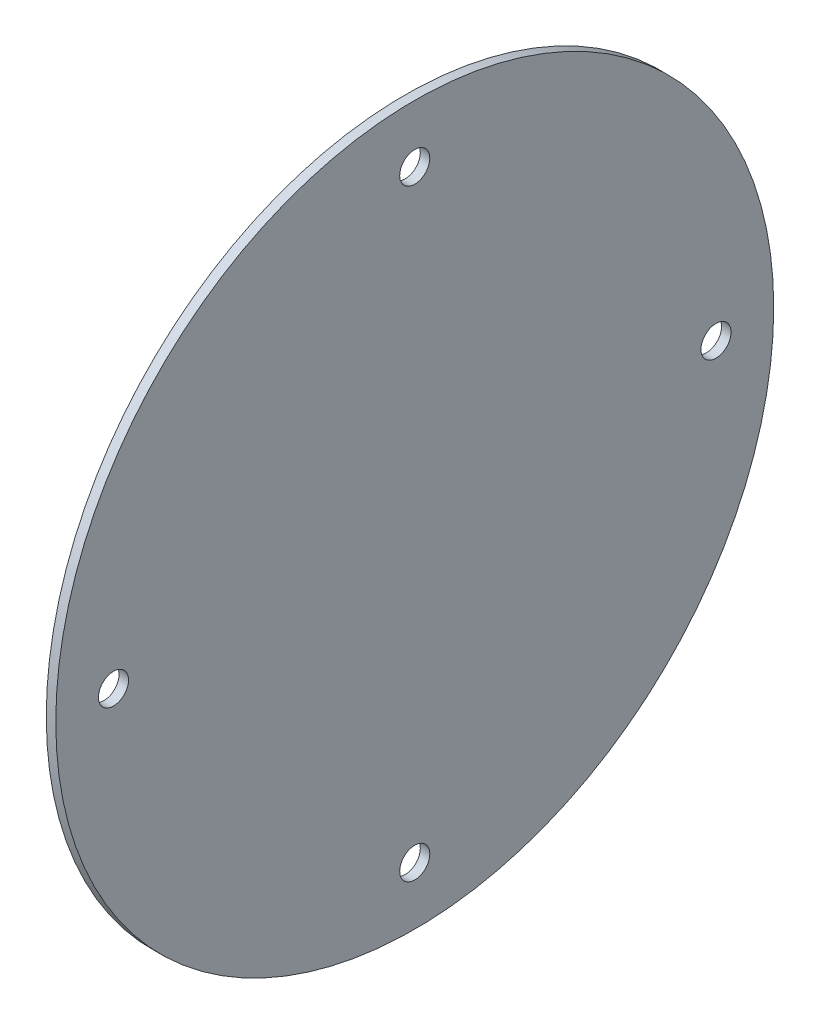
from build123d import *

# Parameters (mm, degrees)
SKETCH1_R           = 75.819
BOSS_EXTRUDE1_DEPTH = 2.0066
SKETCH2_R           = 3.175
CUT_EXTRUDE1_DEPTH  = 108.243032247
CIRPATTERN1_COUNT   = 4


with BuildPart() as part:
    # Sketch1 → Boss-Extrude1 (new body)
    with BuildSketch(Plane.YZ):
        with Locations(Location((0, 0, 0), (0, 0, 270))):
            Circle(SKETCH1_R)
    extrude(amount=BOSS_EXTRUDE1_DEPTH)

    # Sketch2 → Cut-Extrude1 (cut, through all)
    with BuildSketch(Plane.ZY):
        with Locations((63.627, 0)):
            Circle(SKETCH2_R)
    cut_extrude1 = extrude(amount=-CUT_EXTRUDE1_DEPTH, mode=Mode.SUBTRACT)

    # CirPattern1: Cut-Extrude1 ×4 about axis
    cirpattern1_axis = Axis((0, 0, 0), (1, 0, 0))
    for i in range(1, CIRPATTERN1_COUNT):
        add(cut_extrude1.rotate(cirpattern1_axis, i * 360 / CIRPATTERN1_COUNT), mode=Mode.SUBTRACT)


solid = part.part
